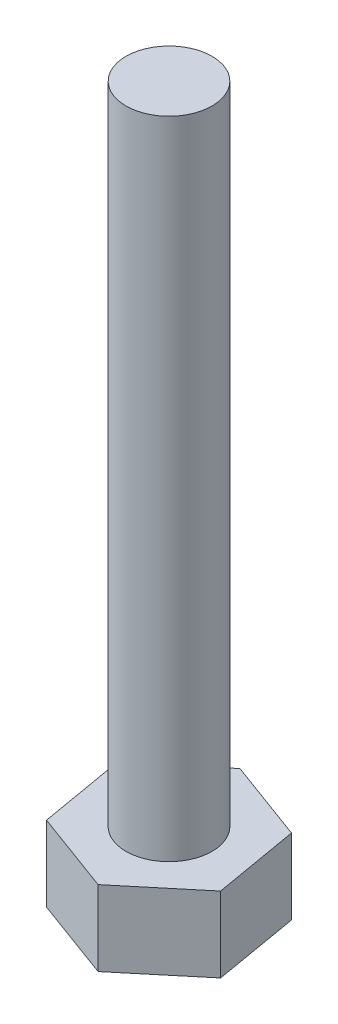
from build123d import *

# Parameters (mm, degrees)
EXTRUDE_1_DEPTH = 3.5
SKETCH_2_R      = 2
EXTRUDE_2_DEPTH = 30


with BuildPart() as part:
    # Эскиз1 → Вытянуть1 (new body)
    with BuildSketch(Plane(origin=(0, 0, 0), x_dir=(1, 0, 0), z_dir=(0, 1, 0))):
        Polygon((3.792939182, -1.395329958), (3.104860782, 2.587116708), (-0.688078401, 3.982446666), (-3.792939182, 1.395329958), (-3.104860782, -2.587116708), (0.688078401, -3.982446666), align=None)
    extrude(amount=EXTRUDE_1_DEPTH)

    # Эскиз2 → Вытянуть2 (add)
    with BuildSketch(Plane(origin=(0, 3.5, 0), x_dir=(1, 0, 0), z_dir=(0, 1, 0))):
        with Locations(Location((0, 0, 0), (0, 0, 270))):
            Circle(SKETCH_2_R)
    extrude(amount=EXTRUDE_2_DEPTH)


solid = part.part
